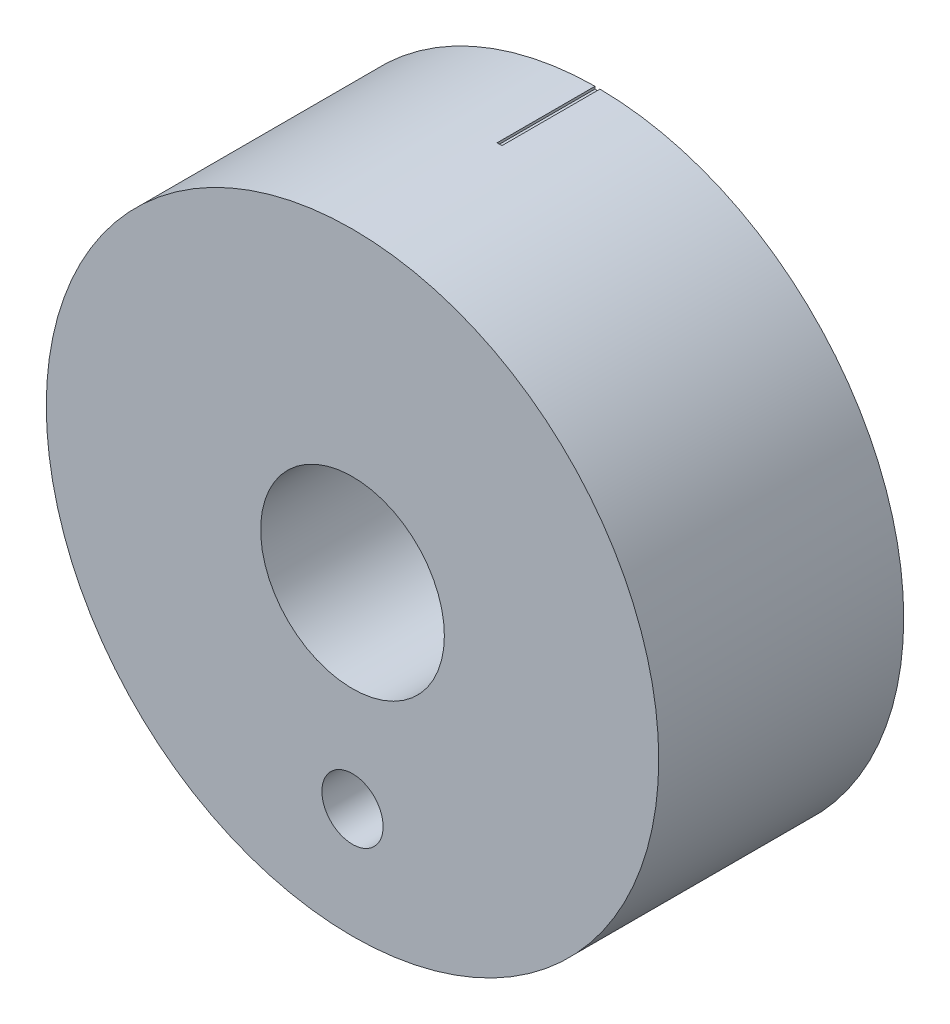
from build123d import *

# Parameters (mm, degrees)
SKETCH1_R                     = 15.875
SKETCH1_R_2                   = 4.7625
BOSS_EXTRUDE1_DEPTH           = 12.7
SKETCH3_W                     = 0.254
SKETCH3_H                     = 0.127
F_001_LINE_CUT_EXTRUDE1_DEPTH = 5.08
F_1_8_0_1250_DOWEL_HOLE1_D    = 3.175


with BuildPart() as part:
    # Sketch1 → Boss-Extrude1 (new body)
    with BuildSketch(Plane.XY):
        Circle(SKETCH1_R)
        Circle(SKETCH1_R_2, mode=Mode.SUBTRACT)
    extrude(amount=-BOSS_EXTRUDE1_DEPTH)

    # Sketch3 → .001 line Cut-Extrude1 (cut)
    with BuildSketch(Plane.XY.offset(-12.7)):
        with Locations((0, 15.8115)):
            Rectangle(SKETCH3_W, SKETCH3_H)
    extrude(amount=F_001_LINE_CUT_EXTRUDE1_DEPTH, mode=Mode.SUBTRACT)

    # 1/8 (0.1250) Dowel Hole1 (through all)
    with Locations(Plane(origin=(0, 0, -12.7), x_dir=(-1, 0, 0), z_dir=(0, 0, -1))):
        with Locations((0, -10.16)):
            Hole(F_1_8_0_1250_DOWEL_HOLE1_D / 2)


solid = part.part
